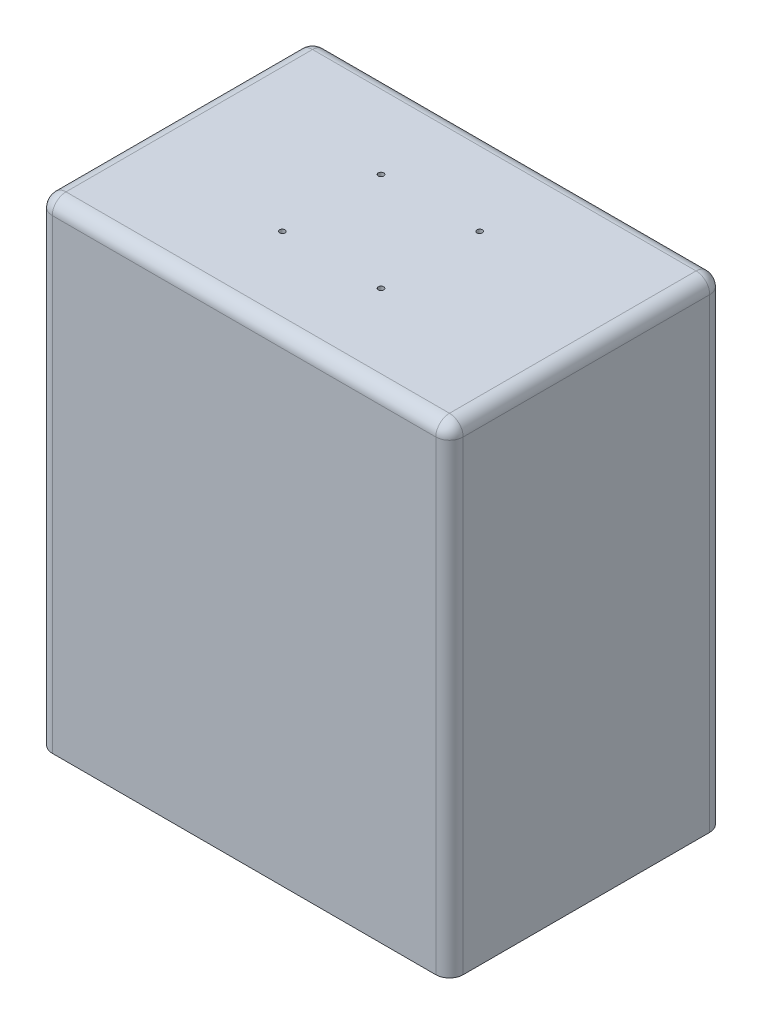
from build123d import *

# Parameters (mm, degrees)
ESQUISSE1_W             = 300
ESQUISSE1_H             = 200
EXTRUSION1_DEPTH        = 350
COQUE2_T                = -5
ESQUISSE2_R             = 2
ENL_V_MAT_EXTRU_1_DEPTH = 394.700393701
CONG_1_R                = 10


with BuildPart() as part:
    # Esquisse1 → Extrusion1 (new body)
    with BuildSketch(Plane(origin=(0, 0, 0), x_dir=(1, 0, 0), z_dir=(0, 1, 0))):
        Rectangle(ESQUISSE1_W, ESQUISSE1_H)
    extrude(amount=EXTRUSION1_DEPTH)

    # Coque2
    coque2_openings = [part.faces().sort_by_distance(p)[0] for p in [
        (0, 0, 0),
    ]]
    offset(amount=COQUE2_T, openings=coque2_openings, kind=Kind.INTERSECTION)

    # Esquisse2 → Enlèv. mat.-Extru.1 (cut, through all)
    with BuildSketch(Plane(origin=(0, 350, 0), x_dir=(1, 0, 0), z_dir=(0, 1, 0))):
        with Locations(Location((-36, 36, 0), (0, 0, 270))):
            Circle(ESQUISSE2_R)
        with Locations(Location((36, 36, 0), (0, 0, 270))):
            Circle(ESQUISSE2_R)
        with Locations(Location((-36, -36, 0), (0, 0, 270))):
            Circle(ESQUISSE2_R)
        with Locations(Location((36, -36, 0), (0, 0, 270))):
            Circle(ESQUISSE2_R)
    extrude(amount=-ENL_V_MAT_EXTRU_1_DEPTH, mode=Mode.SUBTRACT)

    # Congé1
    cong_1_edges = [part.edges().sort_by_distance(p)[0] for p in [
        (150, 350, 0),
        (0, 350, -100),
        (-150, 350, 0),
        (0, 350, 100),
        (-150, 175, -100),
        (150, 175, -100),
        (150, 175, 100),
        (-150, 175, 100),
    ]]
    fillet(cong_1_edges, radius=CONG_1_R)


solid = part.part
